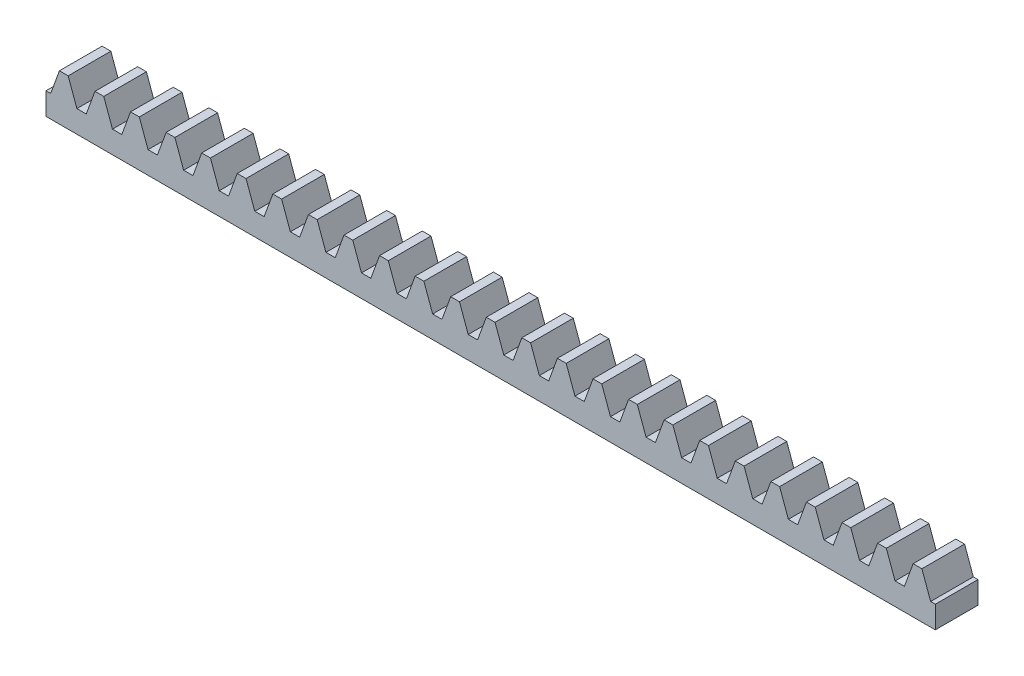
from build123d import *

# Parameters (mm, degrees)
ESBO_O1_W                = 250
ESBO_O1_H                = 13
RESSALTO_EXTRUS_O1_DEPTH = 12
CORTE_EXTRUS_O1_DEPTH    = 251.625218204
PADR_O_LINEAR1_COUNT     = 28
PADR_O_LINEAR1_PITCH     = 10


with BuildPart() as part:
    # Esboço1 → Ressalto-extrusão1 (new body)
    with BuildSketch(Plane.XY):
        with Locations((125, 6.5)):
            Rectangle(ESBO_O1_W, ESBO_O1_H)
    extrude(amount=RESSALTO_EXTRUS_O1_DEPTH)

    # Esboço2 → Corte-extrusão1 (cut, through all)
    with BuildSketch(Plane.XY.offset(12)):
        Polygon((1.312306109, 6.25), (-1.312306109, 6.25), (-3.778350034, 13.0254), (3.778350034, 13.0254), align=None)
    corte_extrus_o1 = extrude(amount=-CORTE_EXTRUS_O1_DEPTH, mode=Mode.SUBTRACT)

    # Padrão linear1: Corte-extrusão1 ×28
    with Locations(*[(i * PADR_O_LINEAR1_PITCH, 0, 0) for i in range(1, PADR_O_LINEAR1_COUNT)]):
        add(corte_extrus_o1, mode=Mode.SUBTRACT)


solid = part.part
